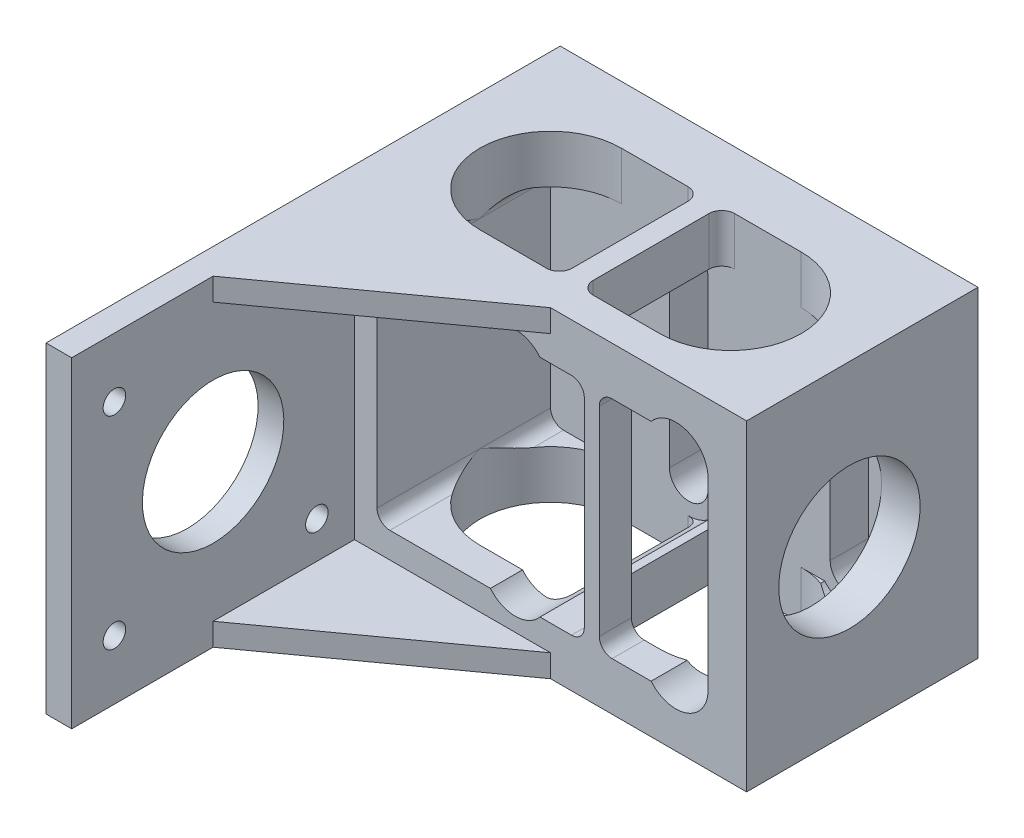
from build123d import *

# Parameters (mm, degrees)
SKIZZE1_W                        = 65
SKIZZE1_H                        = 50
AUFSATZ_LINEAR_AUSTRAGEN1_DEPTH  = 36
SKIZZE2_W                        = 80
SKIZZE2_H                        = 50
AUFSATZ_LINEAR_AUSTRAGEN2_DEPTH  = 4
SKIZZE3_R                        = 11
SKIZZE3_R_2                      = 1.75
SCHNITT_LINEAR_AUSTRAGEN1_DEPTH  = 4
AUFSATZ_LINEAR_AUSTRAGEN3_DEPTH  = 3.5
AUFSATZ_LINEAR_AUSTRAGEN4_DEPTH  = 3.5
SCHNITT_LINEAR_AUSTRAGEN2_DEPTH  = 27
SKIZZE7_R                        = 11
SCHNITT_LINEAR_AUSTRAGEN3_DEPTH  = 54
SCHNITT_LINEAR_AUSTRAGEN4_DEPTH  = 54
SCHNITT_LINEAR_AUSTRAGEN10_DEPTH = 37
SCHNITT_LINEAR_AUSTRAGEN11_DEPTH = 37


with BuildPart() as part:
    # Skizze1 → Aufsatz-Linear austragen1 (new body)
    with BuildSketch(Plane.XY):
        Rectangle(SKIZZE1_W, SKIZZE1_H)
    extrude(amount=AUFSATZ_LINEAR_AUSTRAGEN1_DEPTH)

    # Skizze2 → Aufsatz-Linear austragen2 (add)
    with BuildSketch(Plane.ZY.offset(32.5)):
        with Locations((40, 0)):
            Rectangle(SKIZZE2_W, SKIZZE2_H)
    extrude(amount=-AUFSATZ_LINEAR_AUSTRAGEN2_DEPTH)

    # Skizze3 → Schnitt-Linear austragen1 (cut)
    with BuildSketch(Plane.ZY.offset(32.5)):
        with Locations(Location((58, 0, 0), (0, 0, 270))):
            Circle(SKIZZE3_R)
        with Locations(Location((73.360257159, 15.75, 0), (0, 0, 270))):
            Circle(SKIZZE3_R_2)
        with Locations(Location((73.360257159, -15.75, 0), (0, 0, 270))):
            Circle(SKIZZE3_R_2)
        with Locations(Location((41.860257159, -15.75, 0), (0, 0, 270))):
            Circle(SKIZZE3_R_2)
        with Locations(Location((41.860257159, 15.75, 0), (0, 0, 270))):
            Circle(SKIZZE3_R_2)
    extrude(amount=-SCHNITT_LINEAR_AUSTRAGEN1_DEPTH, mode=Mode.SUBTRACT)

    # Skizze4 → Aufsatz-Linear austragen3 (add)
    with BuildSketch(Plane(origin=(0, 25, 0), x_dir=(1, 0, 0), z_dir=(0, 1, 0))):
        Polygon((-28.5, -58), (2, -36), (-28.5, -36), align=None)
    extrude(amount=-AUFSATZ_LINEAR_AUSTRAGEN3_DEPTH)

    # Skizze5 → Aufsatz-Linear austragen4 (add)
    with BuildSketch(Plane.XZ.offset(25)):
        Polygon((-28.5, 58), (2, 36), (-28.5, 36), align=None)
    extrude(amount=-AUFSATZ_LINEAR_AUSTRAGEN4_DEPTH)

    # Skizze6 → Schnitt-Linear austragen2 (cut)
    with BuildSketch(Plane.XY.offset(36)):
        with BuildLine():
            Line((-23, 17.5), (5.24803832, 17.5))
            ThreePointArc((5.24803832, 17.5), (6.662251883, 16.914213562), (7.24803832, 15.5))
            Line((7.24803832, 15.5), (7.24803832, -15.5))
            ThreePointArc((7.24803832, -15.5), (6.662251883, -16.914213562), (5.24803832, -17.5))
            Line((5.24803832, -17.5), (-23, -17.5))
            ThreePointArc((-23, -17.5), (-24.414213562, -16.914213562), (-25, -15.5))
            Line((-25, -15.5), (-25, 15.5))
            ThreePointArc((-25, 15.5), (-24.414213562, 16.914213562), (-23, 17.5))
        make_face()
        with BuildLine():
            Line((25, 15.5), (25, -15.5))
            ThreePointArc((25, -15.5), (24.414213562, -16.914213562), (23, -17.5))
            Line((23, -17.5), (11.574569139, -17.5))
            ThreePointArc((11.574569139, -17.5), (10.160355577, -16.914213562), (9.574569139, -15.5))
            Line((9.574569139, -15.5), (9.574569139, 15.5))
            ThreePointArc((9.574569139, 15.5), (10.160355577, 16.914213562), (11.574569139, 17.5))
            Line((11.574569139, 17.5), (23, 17.5))
            ThreePointArc((23, 17.5), (24.414213562, 16.914213562), (25, 15.5))
        make_face()
    extrude(amount=-SCHNITT_LINEAR_AUSTRAGEN2_DEPTH, mode=Mode.SUBTRACT)

    # Skizze7 → Schnitt-Linear austragen3 (cut)
    with BuildSketch(Plane(origin=(32.5, 0, 0), x_dir=(0, 0, -1), z_dir=(1, 0, 0))):
        with Locations((-20, 0)):
            Circle(SKIZZE7_R)
    extrude(amount=-SCHNITT_LINEAR_AUSTRAGEN3_DEPTH, mode=Mode.SUBTRACT)

    # Skizze8 → Schnitt-Linear austragen4 (cut)
    with BuildSketch(Plane(origin=(0, 25, 0), x_dir=(1, 0, 0), z_dir=(0, 1, 0))):
        with BuildLine():
            Line((-14, -9), (-3.639017883, -9))
            ThreePointArc((-3.639017883, -9), (-2.22480432, -9.585786438), (-1.639017883, -11))
            Line((-1.639017883, -11), (-1.639017883, -29))
            ThreePointArc((-1.639017883, -29), (-2.22480432, -30.414213562), (-3.639017883, -31))
            Line((-3.639017883, -31), (-14, -31))
            ThreePointArc((-14, -31), (-25, -20), (-14, -9))
        make_face()
        with BuildLine():
            Line((3.639017883, -9), (14, -9))
            ThreePointArc((14, -9), (25, -20), (14, -31))
            Line((14, -31), (3.639017883, -31))
            ThreePointArc((3.639017883, -31), (2.22480432, -30.414213562), (1.639017883, -29))
            Line((1.639017883, -29), (1.639017883, -11))
            ThreePointArc((1.639017883, -11), (2.22480432, -9.585786438), (3.639017883, -9))
        make_face()
    extrude(amount=-SCHNITT_LINEAR_AUSTRAGEN4_DEPTH, mode=Mode.SUBTRACT)

    # Skizze9 → Schnitt-Linear austragen10 (cut)
    with BuildSketch(Plane.XY.offset(9)):
        with BuildLine():
            Line((-0.5, 14.31913721), (-0.5, -14.31913721))
            ThreePointArc((-0.5, -14.31913721), (-3.5, -17.31913721), (-6.5, -14.31913721))
            Line((-6.5, -14.31913721), (-6.5, 14.31913721))
            ThreePointArc((-6.5, 14.31913721), (-3.5, 17.31913721), (-0.5, 14.31913721))
        make_face()
        with BuildLine():
            Line((24.5, 14.31913721), (24.5, -14.31913721))
            ThreePointArc((24.5, -14.31913721), (21.5, -17.31913721), (18.5, -14.31913721))
            Line((18.5, -14.31913721), (18.5, 14.31913721))
            ThreePointArc((18.5, 14.31913721), (21.5, 17.31913721), (24.5, 14.31913721))
        make_face()
    extrude(amount=-SCHNITT_LINEAR_AUSTRAGEN10_DEPTH, mode=Mode.SUBTRACT)

    # Skizze14 → Schnitt-Linear austragen11 (cut)
    with BuildSketch(Plane.XY.offset(9)):
        with BuildLine():
            Line((1.5, 14.31913721), (1.5, -14.31913721))
            ThreePointArc((1.5, -14.31913721), (-3.5, -19.31913721), (-8.5, -14.31913721))
            Line((-8.5, -14.31913721), (-8.5, 14.31913721))
            ThreePointArc((-8.5, 14.31913721), (-3.5, 19.31913721), (1.5, 14.31913721))
        make_face()
        with BuildLine():
            Line((26.5, 14.31913721), (26.5, -14.31913721))
            ThreePointArc((26.5, -14.31913721), (21.5, -19.31913721), (16.5, -14.31913721))
            Line((16.5, -14.31913721), (16.5, 14.31913721))
            ThreePointArc((16.5, 14.31913721), (21.5, 19.31913721), (26.5, 14.31913721))
        make_face()
    extrude(amount=SCHNITT_LINEAR_AUSTRAGEN11_DEPTH, mode=Mode.SUBTRACT)


solid = part.part
